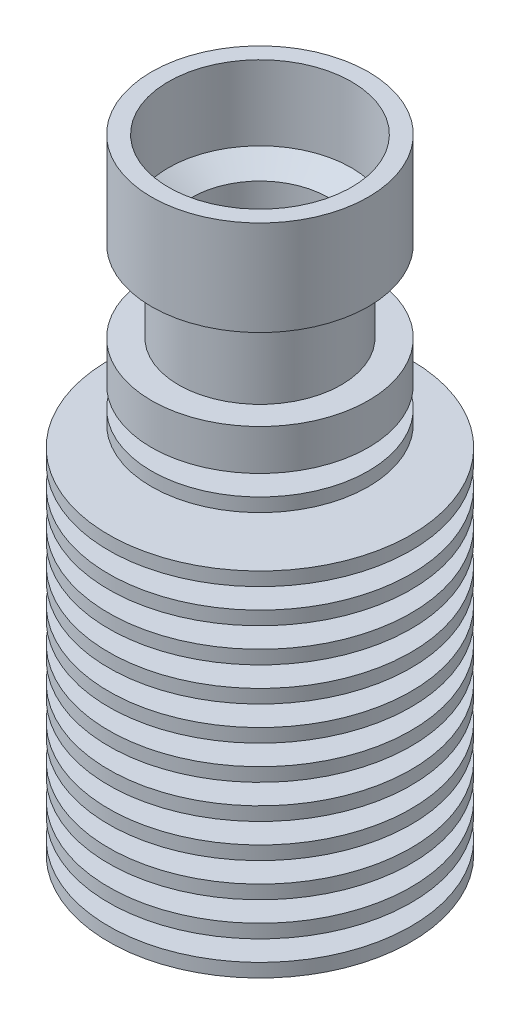
from build123d import *


with BuildPart() as part:
    # Sketch1 → Revolve1 (revolve)
    with BuildSketch(Plane.XY, mode=Mode.PRIVATE) as revolve1_sk:
        Polygon((0, 0), (11.15, 0), (11.15, 1), (5.5, 1), (5.5, 2.5), (11.15, 2.5), (11.15, 3.5), (5.4, 3.5), (5.4, 5), (11.15, 5), (11.15, 6), (5.3, 6), (5.3, 7.5), (11.15, 7.5), (11.15, 8.5), (5.2, 8.5), (5.2, 10), (11.15, 10), (11.15, 11), (5.1, 11), (5.1, 12.5), (11.15, 12.5), (11.15, 13.5), (5, 13.5), (5, 15), (11.15, 15), (11.15, 16), (4.9, 16), (4.9, 17.5), (11.15, 17.5), (11.15, 18.5), (4.8, 18.5), (4.8, 20), (11.15, 20), (11.15, 21), (4.7, 21), (4.7, 22.5), (11.15, 22.5), (11.15, 23.5), (4.6, 23.5), (4.6, 25), (11.15, 25), (11.15, 26), (4.5, 26), (4.5, 27.5), (8, 27.5), (8, 28.5), (4.4, 28.5), (4.4, 30), (8, 30), (8, 33), (6, 33), (6, 39), (8, 39), (8, 46), (0, 46), align=None)
    revolve(revolve1_sk.sketch.rotate(Axis((0, 0, 0), (0, 1, 0)), 90), axis=Axis((0, 0, 0), (0, 1, 0)))

    # Sketch2 → Cut-Revolve1 (revolve, cut)
    with BuildSketch(Plane.XY, mode=Mode.PRIVATE) as cut_revolve1_sk:
        Polygon((0, 46), (6.75, 46), (6.75, 40.5), (5, 39.489637029), (5, 36.489637029), (3.25, 35.479274058), (3.25, 31.5), (1.6, 30.547372056), (1.6, 18.519615242), (2.5, 18), (2.5, 14), (3, 14), (3, 0), (0, 0), align=None)
    revolve(cut_revolve1_sk.sketch.rotate(Axis((0, 0, 0), (0, 1, 0)), 90), axis=Axis((0, 0, 0), (0, 1, 0)), mode=Mode.SUBTRACT)


solid = part.part
